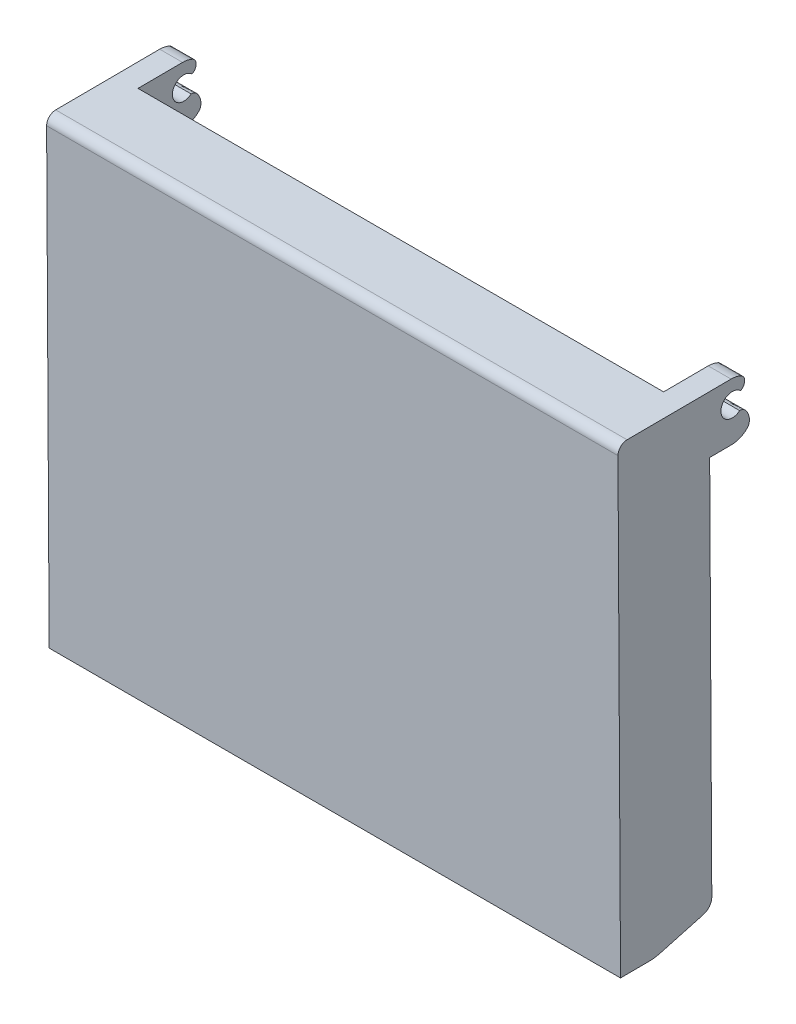
from build123d import *

# Parameters (mm, degrees)
BOSS_EXTRUDE1_DEPTH = 50
FILLET5_R           = 2
SKETCH5_W           = 46
SKETCH5_H           = 5.5
CUT_EXTRUDE1_DEPTH  = 35.5
SKETCH6_R           = 1
CUT_EXTRUDE2_DEPTH  = 50
FILLET8_R           = 2
CUT_EXTRUDE3_DEPTH  = 50
CUT_EXTRUDE4_REACH  = 73.453
CUT_EXTRUDE4_START  = -6
SKETCH9_W           = 46
SKETCH9_H           = 5.08594255


with BuildPart() as part:
    # Sketch1 → Boss-Extrude1 (new body)
    with BuildSketch(Plane(origin=(0, 0, 0), x_dir=(0, 0, -1), z_dir=(1, 0, 0))):
        with BuildLine():
            Line((-3.886543853, 40.629191905), (-3.858449328, 35.629270836))
            Line((-3.858449328, 35.629270836), (-7.758387762, 35.607357106))
            Line((-7.758387762, 35.607357106), (-7.570756078, 2.214957203))
            ThreePointArc((-7.570756078, 2.214957203), (-7.773978903, 1.605044256), (-8.306497887, 1.244882))
            Line((-8.306497887, 1.244882), (-12.050945383, 0.218975681))
            ThreePointArc((-12.050945383, 0.218975681), (-12.563535137, 0.11401769), (-13.085439382, 0.076864019))
            Line((-13.085439382, 0.076864019), (-15.558790346, 0.062966276))
            Line((-15.558790346, 0.062966276), (-15.781860873, 39.762339565))
            ThreePointArc((-15.781860873, 39.762339565), (-15.55072853, 40.329332651), (-14.986368626, 40.56682206))
            Line((-14.986368626, 40.56682206), (-3.886543853, 40.629191905))
        make_face()
    extrude(amount=-BOSS_EXTRUDE1_DEPTH)

    # Fillet5
    fillet5_edges = [part.edges().sort_by_distance(p)[0] for p in [
        (-25, 35.629270836, 3.858449328),
    ]]
    fillet(fillet5_edges, radius=FILLET5_R)

    # Sketch5 → Cut-Extrude1 (cut)
    with BuildSketch(Plane(origin=(0, 0.150386272, 0.00084502), x_dir=(1, 0, 0), z_dir=(0, -0.9999842138288617, -0.005618904971023238))):
        with Locations((-25, 10.308190931)):
            Rectangle(SKETCH5_W, SKETCH5_H)
    extrude(amount=-CUT_EXTRUDE1_DEPTH, mode=Mode.SUBTRACT)

    # Sketch6 → Cut-Extrude2 (cut)
    with BuildSketch(Plane(origin=(0, 0, 0), x_dir=(0, 0, -1), z_dir=(1, 0, 0))):
        with Locations((-5.775276049, 38.618547558)):
            Circle(SKETCH6_R)
    extrude(amount=-CUT_EXTRUDE2_DEPTH, mode=Mode.SUBTRACT)

    # Fillet8
    fillet8_edges = [part.edges().sort_by_distance(p)[0] for p in [
        (-25, 40.629191905, 3.886543853),
    ]]
    fillet(fillet8_edges, radius=FILLET8_R)

    # Sketch7 → Cut-Extrude3 (cut)
    with BuildSketch(Plane(origin=(0, 0, 0), x_dir=(0, 0, -1), z_dir=(1, 0, 0))):
        with BuildLine():
            Line((-5.546917351, 39.592124625), (-5.546917351, 37.644970491))
            add(Edge.make_bspline(
                [(-5.546917351, 37.644970491), (-4.707853676, 38.427857511), (-3.932802052, 36.795264926), (-4.447517997, 36.211756548)],
                knots=[0, 0, 0, 0, 1, 1, 1, 1], degree=3))
            Line((-4.447517997, 36.211756548), (-3.72986133, 36.211756548))
            Line((-3.72986133, 36.211756548), (-3.72986133, 40.421981197))
            Line((-3.72986133, 40.421981197), (-5.011793069, 40.421981197))
            add(Edge.make_bspline(
                [(-5.272048409, 39.482701446), (-5.081010169, 39.321292536), (-4.954269224, 39.348440279), (-4.587478606, 39.771100718), (-4.694245253, 40.267694009), (-5.011793069, 40.421981197)],
                knots=[0, 0, 0, 0, 0.130864933, 0.344471665, 1, 1, 1, 1], degree=3))
            add(Edge.make_bspline(
                [(-5.546917351, 39.592124625), (-5.444164643, 39.566706147), (-5.272048409, 39.482701446)],
                knots=[0, 0, 0, 1, 1, 1], degree=2))
        make_face()
    extrude(amount=-CUT_EXTRUDE3_DEPTH, mode=Mode.SUBTRACT)

    # Sketch9 → Cut-Extrude4 (cut, up to next)
    with BuildSketch(Plane(origin=(0, -0.087419996, 15.557945326), x_dir=(1, 0, 0), z_dir=(0, -0.00561890497102722, 0.9999842138288618)).offset(CUT_EXTRUDE4_START), mode=Mode.PRIVATE) as cut_extrude4_sk1:
        with Locations((-25, 38.193359921)):
            Rectangle(SKETCH9_W, SKETCH9_H)
    cut_extrude4_tool1 = extrude(cut_extrude4_sk1.sketch, amount=-CUT_EXTRUDE4_REACH, mode=Mode.PRIVATE) & part.part
    add(cut_extrude4_tool1.solids().sort_by_distance((-25, 38.13905, 9.772645))[0], mode=Mode.SUBTRACT)


solid = part.part
